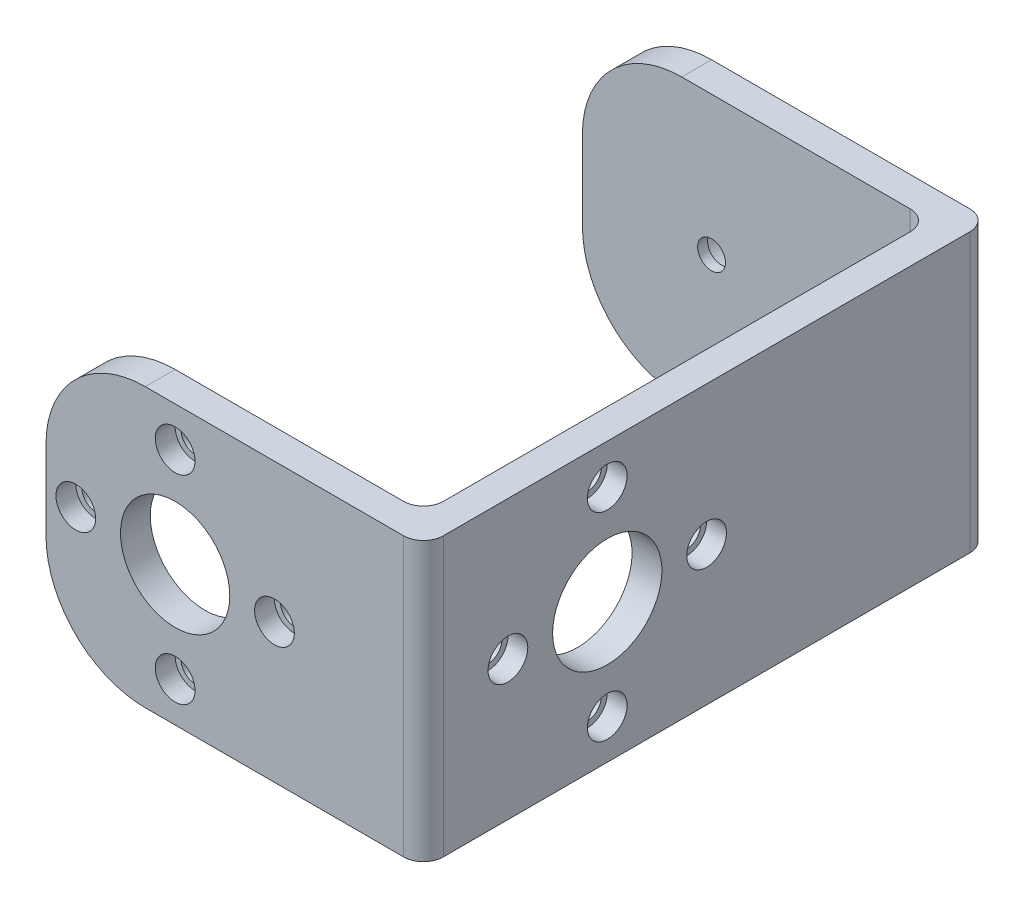
from build123d import *

# Parameters (mm, degrees)
BOSS_EXTRUDE1_DEPTH = 28
SKETCH2_R           = 1.4
SKETCH2_R_2         = 5.5
CUT_EXTRUDE1_DEPTH  = 54.115440316
CUT_EXTRUDE2_REACH  = 68.287
SKETCH3_R           = 1.4
SKETCH3_R_2         = 5.5
CUT_EXTRUDE3_REACH  = 68.287
SKETCH4_R           = 1.4
SKETCH5_R           = 2
CUT_EXTRUDE4_DEPTH  = 2
SKETCH6_R           = 2
CUT_EXTRUDE5_DEPTH  = 2
SKETCH7_R           = 2.5
CUT_EXTRUDE6_DEPTH  = 2
FILLET1_R           = 10
FILLET2_R           = 2


with BuildPart() as part:
    # Sketch1 → Boss-Extrude1 (new body)
    with BuildSketch(Plane(origin=(0, 0, 0), x_dir=(1, 0, 0), z_dir=(0, 1, 0))):
        Polygon((-19, -28.5), (19, -28.5), (19, 28.5), (-19, 28.5), (-19, 25.5), (16, 25.5), (16, -25.5), (-19, -25.5), align=None)
    extrude(amount=BOSS_EXTRUDE1_DEPTH)

    # Sketch2 → Cut-Extrude1 (cut, through all)
    with BuildSketch(Plane.ZY.offset(-16)):
        with Locations((10, 4)):
            Circle(SKETCH2_R)
        with Locations((10, 24)):
            Circle(SKETCH2_R)
        with Locations((0, 14)):
            Circle(SKETCH2_R)
        with Locations((20, 14)):
            Circle(SKETCH2_R)
        with Locations((10, 14)):
            Circle(SKETCH2_R_2)
    extrude(amount=-CUT_EXTRUDE1_DEPTH, mode=Mode.SUBTRACT)

    # Sketch3 → Cut-Extrude2 (cut, up to next)
    with BuildSketch(Plane.XY.offset(28.5), mode=Mode.PRIVATE) as cut_extrude2_sk1:
        with Locations((-16, 14)):
            Circle(SKETCH3_R)
    cut_extrude2_tool1 = extrude(cut_extrude2_sk1.sketch, amount=-CUT_EXTRUDE2_REACH, mode=Mode.PRIVATE) & part.part
    # Sketch3 → Cut-Extrude2 (cut, up to next)
    with BuildSketch(Plane.XY.offset(28.5), mode=Mode.PRIVATE) as cut_extrude2_sk2:
        with Locations((-6, 4)):
            Circle(SKETCH3_R)
    cut_extrude2_tool2 = extrude(cut_extrude2_sk2.sketch, amount=-CUT_EXTRUDE2_REACH, mode=Mode.PRIVATE) & part.part
    # Sketch3 → Cut-Extrude2 (cut, up to next)
    with BuildSketch(Plane.XY.offset(28.5), mode=Mode.PRIVATE) as cut_extrude2_sk3:
        with Locations((4, 14)):
            Circle(SKETCH3_R)
    cut_extrude2_tool3 = extrude(cut_extrude2_sk3.sketch, amount=-CUT_EXTRUDE2_REACH, mode=Mode.PRIVATE) & part.part
    # Sketch3 → Cut-Extrude2 (cut, up to next)
    with BuildSketch(Plane.XY.offset(28.5), mode=Mode.PRIVATE) as cut_extrude2_sk4:
        with Locations((-6, 24)):
            Circle(SKETCH3_R)
    cut_extrude2_tool4 = extrude(cut_extrude2_sk4.sketch, amount=-CUT_EXTRUDE2_REACH, mode=Mode.PRIVATE) & part.part
    # Sketch3 → Cut-Extrude2 (cut, up to next)
    with BuildSketch(Plane.XY.offset(28.5), mode=Mode.PRIVATE) as cut_extrude2_sk5:
        with Locations((-6, 14)):
            Circle(SKETCH3_R_2)
    cut_extrude2_tool5 = extrude(cut_extrude2_sk5.sketch, amount=-CUT_EXTRUDE2_REACH, mode=Mode.PRIVATE) & part.part
    add(cut_extrude2_tool1.solids().sort_by_distance((-16, 14, 28.5))[0], mode=Mode.SUBTRACT)
    add(cut_extrude2_tool2.solids().sort_by_distance((-6, 4, 28.5))[0], mode=Mode.SUBTRACT)
    add(cut_extrude2_tool3.solids().sort_by_distance((4, 14, 28.5))[0], mode=Mode.SUBTRACT)
    add(cut_extrude2_tool4.solids().sort_by_distance((-6, 24, 28.5))[0], mode=Mode.SUBTRACT)
    add(cut_extrude2_tool5.solids().sort_by_distance((-6, 14, 28.5))[0], mode=Mode.SUBTRACT)

    # Sketch4 → Cut-Extrude3 (cut, up to next)
    with BuildSketch(Plane(origin=(0, 0, -28.5), x_dir=(-1, 0, 0), z_dir=(0, 0, -1)), mode=Mode.PRIVATE) as cut_extrude3_sk1:
        with Locations((6, 14)):
            Circle(SKETCH4_R)
    cut_extrude3_tool1 = extrude(cut_extrude3_sk1.sketch, amount=-CUT_EXTRUDE3_REACH, mode=Mode.PRIVATE) & part.part
    add(cut_extrude3_tool1.solids().sort_by_distance((-6, 14, -28.5))[0], mode=Mode.SUBTRACT)

    # Sketch5 → Cut-Extrude4 (cut)
    with BuildSketch(Plane.XY.offset(28.5)):
        with Locations((-16, 14)):
            Circle(SKETCH5_R)
        with Locations((-6, 24)):
            Circle(SKETCH5_R)
        with Locations((4, 14)):
            Circle(SKETCH5_R)
        with Locations((-6, 4)):
            Circle(SKETCH5_R)
    extrude(amount=-CUT_EXTRUDE4_DEPTH, mode=Mode.SUBTRACT)

    # Sketch6 → Cut-Extrude5 (cut)
    with BuildSketch(Plane(origin=(19, 0, 0), x_dir=(0, 0, -1), z_dir=(1, 0, 0))):
        with Locations((-10, 24)):
            Circle(SKETCH6_R)
        with Locations((0, 14)):
            Circle(SKETCH6_R)
        with Locations((-10, 4)):
            Circle(SKETCH6_R)
        with Locations((-20, 14)):
            Circle(SKETCH6_R)
    extrude(amount=-CUT_EXTRUDE5_DEPTH, mode=Mode.SUBTRACT)

    # Sketch7 → Cut-Extrude6 (cut)
    with BuildSketch(Plane(origin=(0, 0, -28.5), x_dir=(-1, 0, 0), z_dir=(0, 0, -1))):
        with Locations((6, 14)):
            Circle(SKETCH7_R)
    extrude(amount=-CUT_EXTRUDE6_DEPTH, mode=Mode.SUBTRACT)

    # Fillet1
    fillet1_edges = [part.edges().sort_by_distance(p)[0] for p in [
        (-19, 0, 27),
        (-19, 28, 27),
        (-19, 28, -27),
        (-19, 0, -27),
    ]]
    fillet(fillet1_edges, radius=FILLET1_R)

    # Fillet2
    fillet2_edges = [part.edges().sort_by_distance(p)[0] for p in [
        (19, 14, -28.5),
        (19, 14, 28.5),
        (16, 14, 25.5),
        (16, 14, -25.5),
    ]]
    fillet(fillet2_edges, radius=FILLET2_R)


solid = part.part
